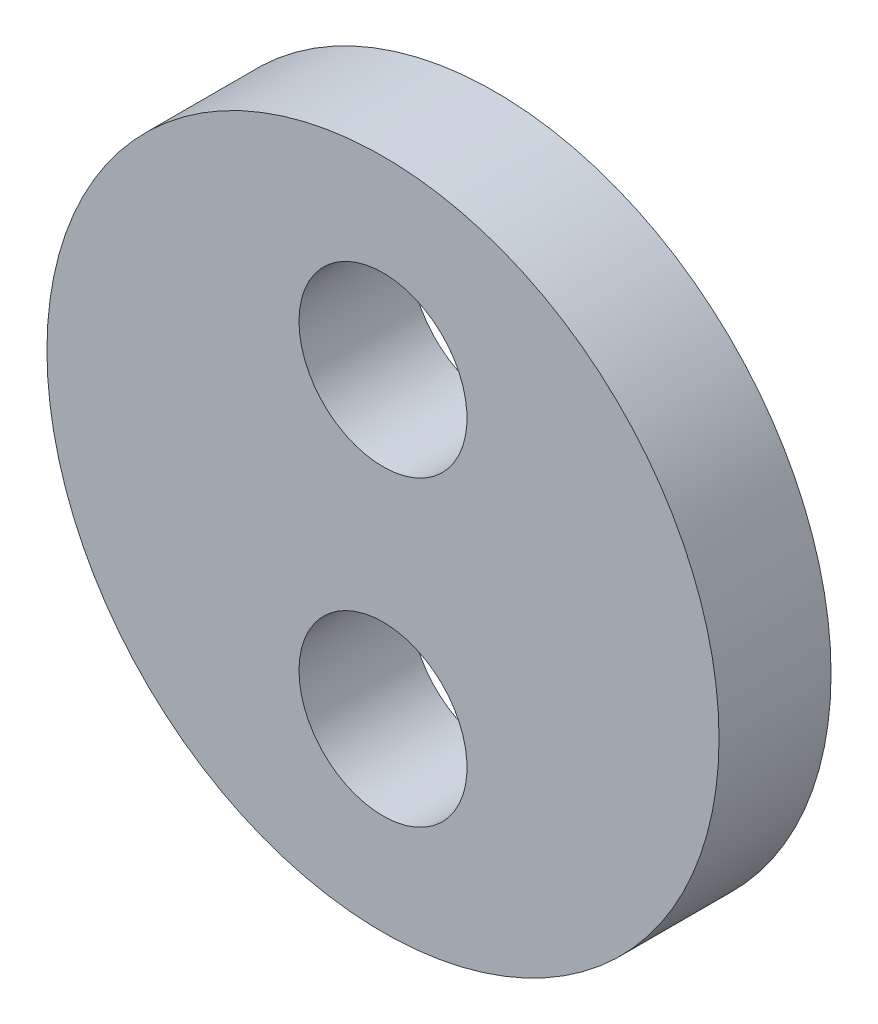
from build123d import *

# Parameters (mm, degrees)
BOSS_EXTRUDE1_START = 0.5
SKETCH2_R           = 6
SKETCH2_R_2         = 1.5
BOSS_EXTRUDE1_DEPTH = 2


with BuildPart() as part:
    # Sketch2 → Boss-Extrude1 (new body)
    with BuildSketch(Plane.XY.offset(BOSS_EXTRUDE1_START)):
        with Locations(Location((0, 0, 0), (0, 0, 180))):
            Circle(SKETCH2_R)
        with Locations(Location((0, 2.7, 0), (0, 0, 180))):
            Circle(SKETCH2_R_2, mode=Mode.SUBTRACT)
        with Locations(Location((0, -2.7, 0), (0, 0, 180))):
            Circle(SKETCH2_R_2, mode=Mode.SUBTRACT)
    extrude(amount=BOSS_EXTRUDE1_DEPTH)


solid = part.part
